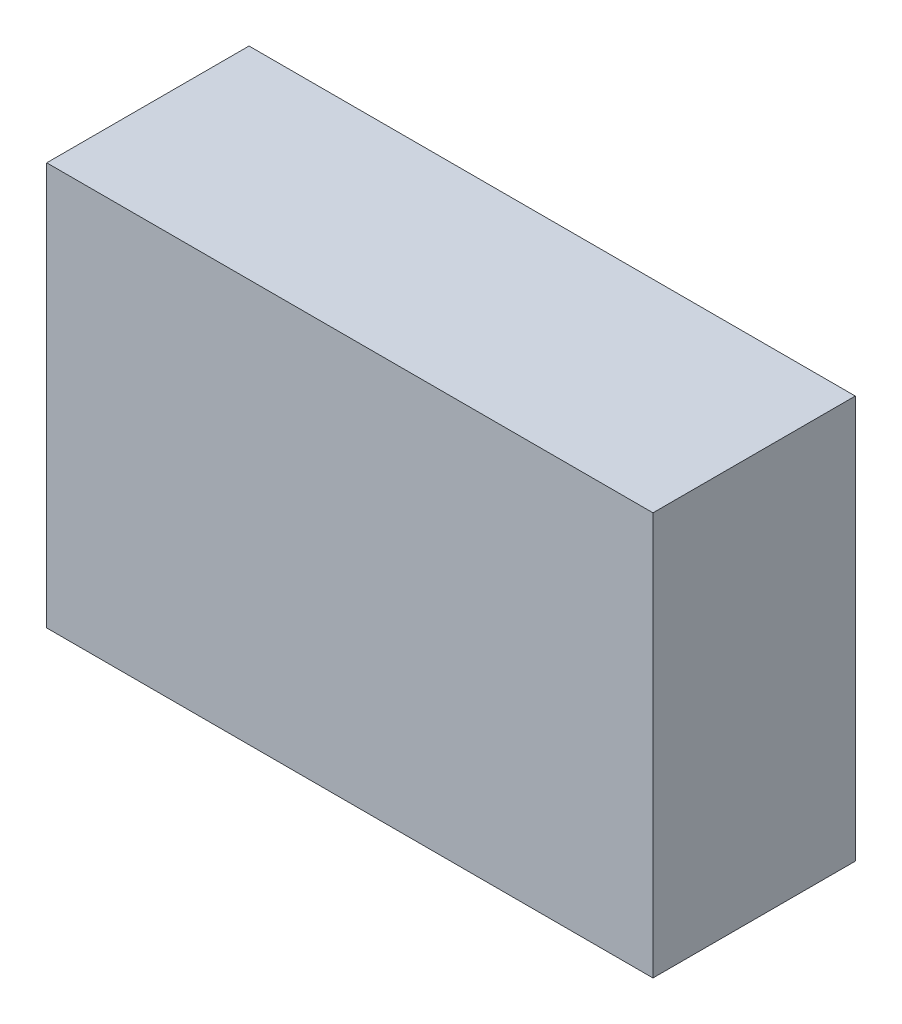
from build123d import *

# Parameters (mm, degrees)
SKIZZE1_W               = 2.9968
SKIZZE1_H               = 1.9914
COMPONENT_OUTLINE_DEPTH = 1


with BuildPart() as part:
    # Skizze1 → Component_Outline (new body)
    with BuildSketch(Plane.XY):
        with Locations((0, 0.0127)):
            Rectangle(SKIZZE1_W, SKIZZE1_H)
    extrude(amount=COMPONENT_OUTLINE_DEPTH)


solid = part.part
